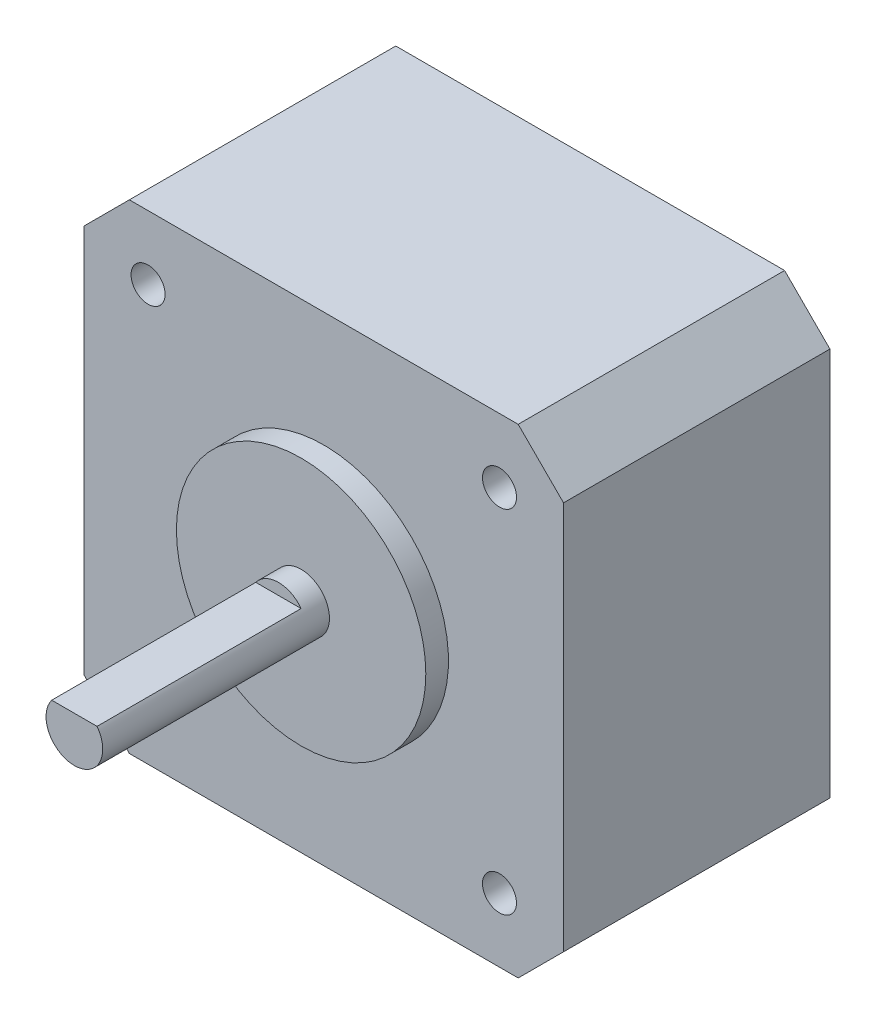
from build123d import *

# Parameters (mm, degrees)
SKETCH1_R           = 1.5
BOSS_EXTRUDE1_DEPTH = 23.5
SKETCH2_W           = 16.2
SKETCH2_H           = 9.2
BOSS_EXTRUDE2_DEPTH = 5.5
SKETCH3_R           = 11
BOSS_EXTRUDE3_DEPTH = 2
SKETCH4_R           = 2.5
BOSS_EXTRUDE4_DEPTH = 20
SKETCH5_W           = 5
SKETCH5_H           = 18
CUT_EXTRUDE1_DEPTH  = 1


with BuildPart() as part:
    # Sketch1 → Boss-Extrude1 (new body)
    with BuildSketch(Plane.XY):
        Polygon((-17.15, -21.15), (17.15, -21.15), (21.15, -17.15), (21.15, 17.15), (17.15, 21.15), (-17.15, 21.15), (-21.15, 17.15), (-21.15, -17.15), align=None)
        with Locations((-15.5, 15.5)):
            Circle(SKETCH1_R, mode=Mode.SUBTRACT)
        with Locations((15.5, 15.5)):
            Circle(SKETCH1_R, mode=Mode.SUBTRACT)
        with Locations((15.5, -15.5)):
            Circle(SKETCH1_R, mode=Mode.SUBTRACT)
        with Locations((-15.5, -15.5)):
            Circle(SKETCH1_R, mode=Mode.SUBTRACT)
    extrude(amount=BOSS_EXTRUDE1_DEPTH)

    # Sketch2 → Boss-Extrude2 (add)
    with BuildSketch(Plane.XZ.offset(21.15)):
        with Locations((0, 4.6)):
            Rectangle(SKETCH2_W, SKETCH2_H)
    extrude(amount=BOSS_EXTRUDE2_DEPTH)

    # Sketch3 → Boss-Extrude3 (add)
    with BuildSketch(Plane.XY.offset(23.5)):
        with Locations(Location((0, 0, 0), (0, 0, 180))):
            Circle(SKETCH3_R)
    extrude(amount=BOSS_EXTRUDE3_DEPTH)

    # Sketch4 → Boss-Extrude4 (add)
    with BuildSketch(Plane.XY.offset(25.5)):
        Circle(SKETCH4_R)
    extrude(amount=BOSS_EXTRUDE4_DEPTH)

    # Sketch5 → Cut-Extrude1 (cut)
    with BuildSketch(Plane(origin=(0, 2.5, 0), x_dir=(1, 0, 0), z_dir=(0, 1, 0))):
        with Locations((0, -36.5)):
            Rectangle(SKETCH5_W, SKETCH5_H)
    extrude(amount=-CUT_EXTRUDE1_DEPTH, mode=Mode.SUBTRACT)


solid = part.part
